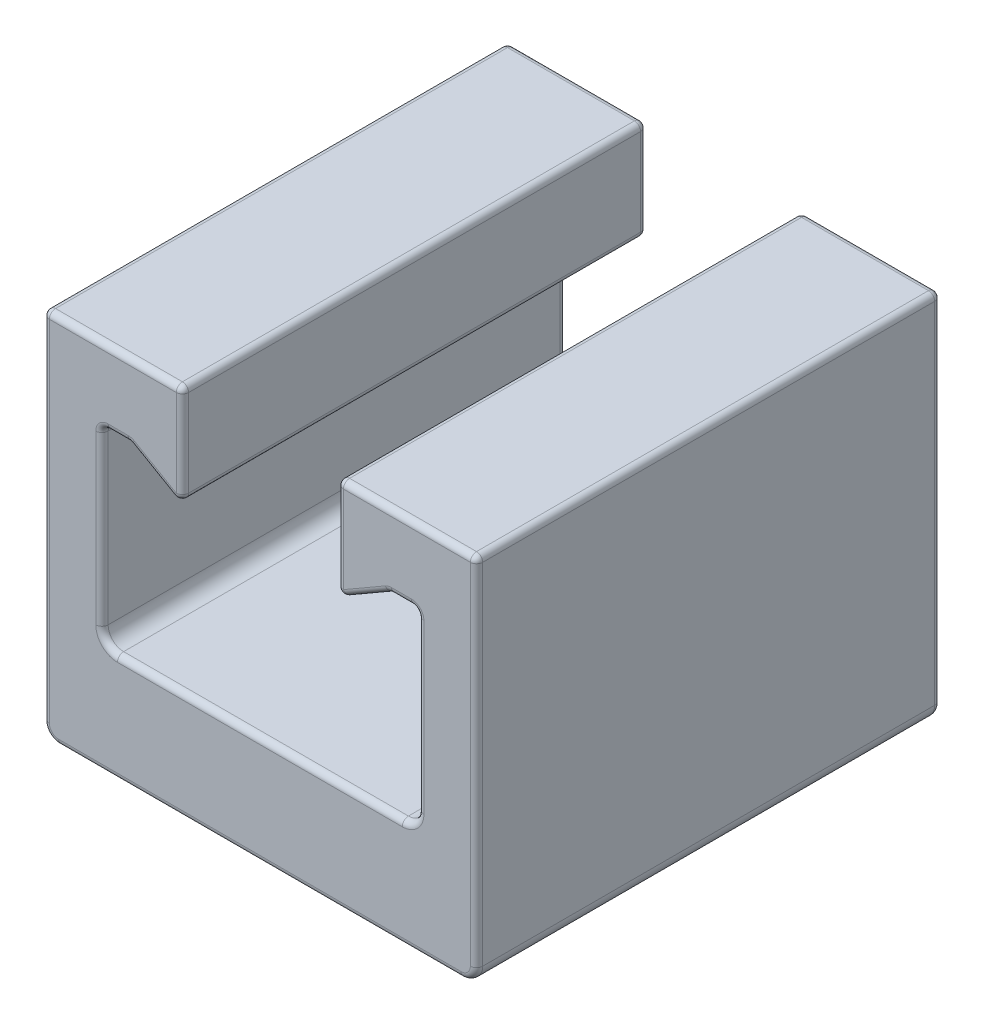
from build123d import *

# Parameters (mm, degrees)
BOSS_EXTRUDE1_DEPTH = 15
FILLET1_R           = 0.2
FILLET2_R           = 0.5
FILLET3_R           = 0.2


with BuildPart() as part:
    # Sketch1 → Boss-Extrude1 (new body)
    with BuildSketch(Plane.XY):
        Polygon((-4.5, 5.519615242), (-4.5, 7.8988893), (-7, 7.8988893), (-7, -4.1011107), (7, -4.1011107), (7, 7.8988893), (4.5, 7.8988893), (4.5, 5.519615242), (5.1, 5.519615242), (5.1, -0.6), (-5.1, -0.6), (-5.1, 5.519615242), align=None)
        Polygon((-2.5, 7.8988893), (-4.5, 7.8988893), (-4.5, 5.519615242), (-4.2, 5.519615242), (-2.5, 4.538119785), align=None)
        Polygon((4.5, 7.8988893), (2.5, 7.8988893), (2.5, 4.538119785), (4.2, 5.519615242), (4.5, 5.519615242), align=None)
    extrude(amount=BOSS_EXTRUDE1_DEPTH)

    # Fillet1
    fillet1_edges = [part.edges().sort_by_distance(p)[0] for p in [
        (4.2, 5.519615242, 7.5),
        (2.5, 4.538119785, 7.5),
        (2.5, 7.8988893, 7.5),
        (7, 7.8988893, 7.5),
        (-7, 7.8988893, 7.5),
        (-2.5, 7.8988893, 7.5),
        (-2.5, 4.538119785, 7.5),
        (-4.2, 5.519615242, 7.5),
        (-5.1, 5.519615242, 7.5),
        (5.1, 5.519615242, 7.5),
    ]]
    fillet(fillet1_edges, radius=FILLET1_R)

    # Fillet2
    fillet2_edges = [part.edges().sort_by_distance(p)[0] for p in [
        (7, -4.1011107, 7.5),
        (-7, -4.1011107, 7.5),
        (-5.1, -0.6, 7.5),
        (5.1, -0.6, 7.5),
    ]]
    fillet(fillet2_edges, radius=FILLET2_R)

    # Fillet3
    fillet3_edges = [part.edges().sort_by_distance(p)[0] for p in [
        (0, -4.1011107, 0),
        (0, -4.1011107, 15),
        (0, -0.6, 0),
        (5.1, 2.609807621, 0),
        (7, 2.0488893, 0),
        (6.853553391, -3.95466409, 0),
        (-6.853553391, -3.95466409, 0),
        (7, 2.0488893, 15),
        (5.1, 2.609807621, 15),
        (0, -0.6, 15),
        (6.853553391, -3.95466409, 15),
        (-6.853553391, -3.95466409, 15),
        (-4.953553391, -0.453553391, 0),
        (-4.953553391, -0.453553391, 15),
        (4.953553391, -0.453553391, 0),
        (4.953553391, -0.453553391, 15),
        (4.576794919, 5.519615242, 0),
        (4.576794919, 5.519615242, 15),
        (3.476794919, 5.102072594, 0),
        (3.476794919, 5.102072594, 15),
        (-3.476794919, 5.102072594, 0),
        (-3.476794919, 5.102072594, 15),
        (-4.576794919, 5.519615242, 0),
        (-4.576794919, 5.519615242, 15),
        (-5.1, 2.609807621, 0),
        (-5.1, 2.609807621, 15),
        (-7, 2.0488893, 0),
        (-7, 2.0488893, 15),
        (2.5, 6.291709623, 0),
        (4.75, 7.8988893, 0),
        (-4.75, 7.8988893, 0),
        (-2.5, 6.291709623, 0),
        (2.6, 4.711324865, 0),
        (-2.6, 4.711324865, 0),
        (-2.558578644, 7.840310656, 0),
        (2.558578644, 7.840310656, 0),
        (6.941421356, 7.840310656, 0),
        (-6.941421356, 7.840310656, 0),
        (-4.75, 7.8988893, 15),
        (-2.5, 6.291709623, 15),
        (4.75, 7.8988893, 15),
        (2.5, 6.291709623, 15),
        (2.6, 4.711324865, 15),
        (-2.6, 4.711324865, 15),
        (-2.558578644, 7.840310656, 15),
        (2.558578644, 7.840310656, 15),
        (6.941421356, 7.840310656, 15),
        (-6.941421356, 7.840310656, 15),
        (5.041421356, 5.461036599, 0),
        (5.041421356, 5.461036599, 15),
        (4.201826029, 5.512800408, 0),
        (4.201826029, 5.512800408, 15),
        (-4.201826029, 5.512800408, 0),
        (-4.201826029, 5.512800408, 15),
        (-5.041421356, 5.461036599, 0),
        (-5.041421356, 5.461036599, 15),
    ]]
    fillet(fillet3_edges, radius=FILLET3_R)


solid = part.part
